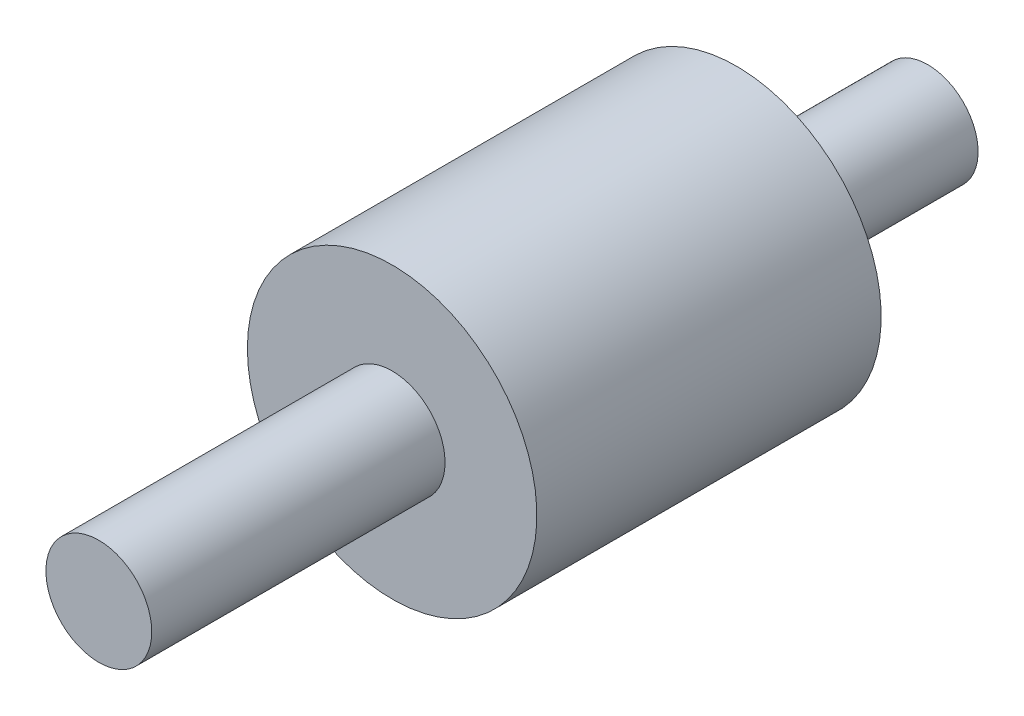
from build123d import *

# Parameters (mm, degrees)
SKETCH1_R           = 4.15
BOSS_EXTRUDE1_DEPTH = 23
SKETCH2_R           = 11.35
BOSS_EXTRUDE2_DEPTH = 27
SKETCH3_R           = 3.95
BOSS_EXTRUDE3_DEPTH = 15


with BuildPart() as part:
    # Sketch1 → Boss-Extrude1 (new body)
    with BuildSketch(Plane.XY):
        Circle(SKETCH1_R)
    extrude(amount=BOSS_EXTRUDE1_DEPTH)

    # Sketch2 → Boss-Extrude2 (add)
    with BuildSketch(Plane(origin=(0, 0, 0), x_dir=(-1, 0, 0), z_dir=(0, 0, -1))):
        Circle(SKETCH2_R)
    extrude(amount=BOSS_EXTRUDE2_DEPTH)

    # Sketch3 → Boss-Extrude3 (add)
    with BuildSketch(Plane(origin=(0, 0, -27), x_dir=(-1, 0, 0), z_dir=(0, 0, -1))):
        Circle(SKETCH3_R)
    extrude(amount=BOSS_EXTRUDE3_DEPTH)


solid = part.part
